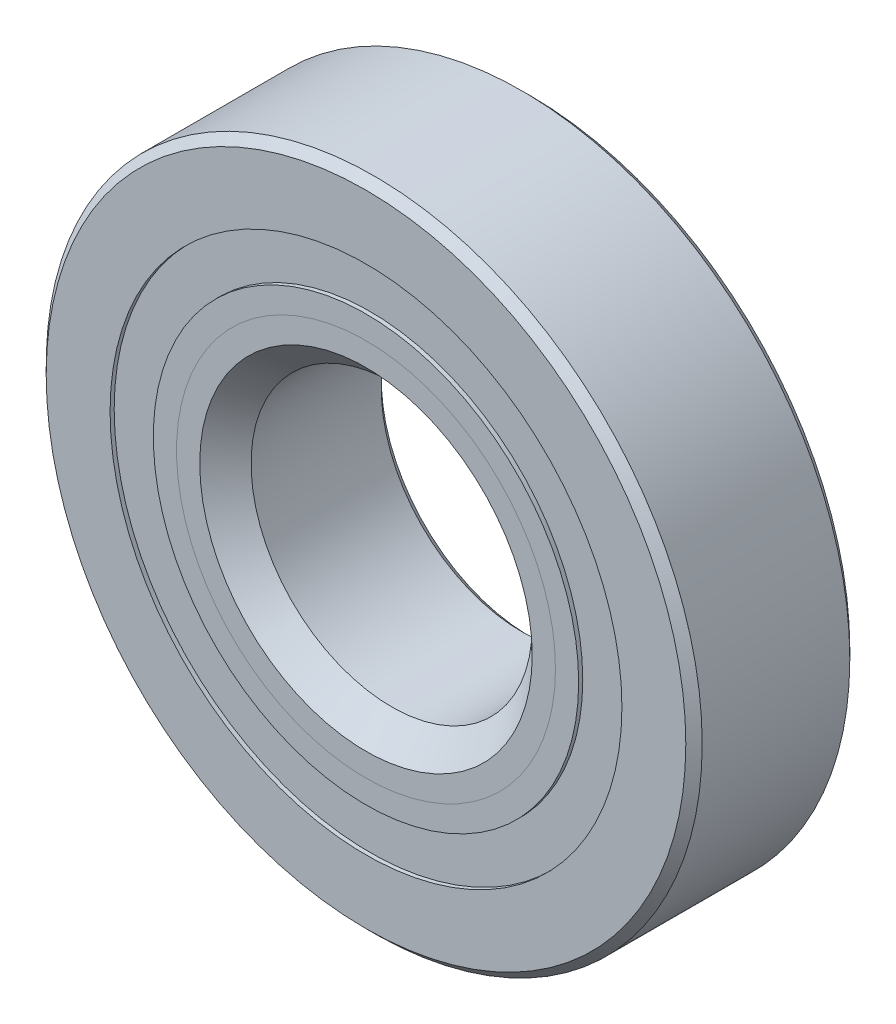
from build123d import *

# Parameters (mm, degrees)
CIRPATTERN1_COUNT = 12
SKETCH5_W         = 1.203469126
SKETCH5_H         = 1.465384616


with BuildPart() as part:
    # Sketch1 → Revolve1 (revolve)
    with BuildSketch(Plane(origin=(0, 0, 0), x_dir=(0, 0, -1), z_dir=(1, 0, 0))):
        with BuildLine():
            Line((2.5003125, 11.1125), (-2.5003125, 11.1125))
            Line((-2.5003125, 11.1125), (-2.778125, 10.8346875))
            Line((-2.778125, 10.8346875), (-2.778125, 8.670192308))
            Line((-2.778125, 8.670192308), (-1.234722222, 8.670192308))
            ThreePointArc((-1.234722222, 8.670192308), (0, 9.373249624), (1.234722222, 8.670192308))
            Line((1.234722222, 8.670192308), (2.778125, 8.670192308))
            Line((2.778125, 8.670192308), (2.778125, 10.8346875))
            Line((2.778125, 10.8346875), (2.5003125, 11.1125))
        make_face()
    revolve(axis=Axis((0, 0, 2.778125), (0, 0, -1)))


with BuildPart() as body_2:
    # Sketch2 → Revolve2 (revolve)
    with BuildSketch(Plane(origin=(0, 0, 0), x_dir=(0, 0, -1), z_dir=(1, 0, 0))):
        with BuildLine():
            Line((-2.778125, 7.204807692), (-1.234722222, 7.204807692))
            ThreePointArc((-1.234722222, 7.204807692), (-0.710427434, 6.689834242), (0, 6.501750376))
            Line((0, 6.501750376), (0, 5.632125188))
            Line((0, 5.632125188), (-1.991783748, 5.632125188))
            Line((-1.991783748, 5.632125188), (-2.778125, 6.41846644))
            Line((-2.778125, 6.41846644), (-2.778125, 7.204807692))
        make_face()
    revolve(axis=Axis((0, 0, 2.778125), (0, 0, -1)))


with BuildPart() as body_3:
    # Sketch3 → Revolve3 (revolve)
    with BuildSketch(Plane(origin=(0, 0, 0), x_dir=(0, 0, -1), z_dir=(1, 0, 0))):
        with BuildLine():
            Line((-2.778125, 6.41846644), (-1.991783748, 5.632125188))
            Line((-1.991783748, 5.632125188), (0, 5.632125188))
            Line((0, 5.632125188), (0, 6.501750376))
            ThreePointArc((0, 6.501750376), (0.710427434, 6.689834242), (1.234722222, 7.204807692))
            Line((1.234722222, 7.204807692), (2.778125, 7.204807692))
            Line((2.778125, 7.204807692), (2.778125, 5.0403125))
            Line((2.778125, 5.0403125), (2.5003125, 4.7625))
            Line((2.5003125, 4.7625), (-1.908499812, 4.7625))
            Line((-1.908499812, 4.7625), (-2.778125, 5.632125188))
            Line((-2.778125, 5.632125188), (-2.778125, 6.41846644))
        make_face()
    revolve(axis=Axis((0, 0, 2.778125), (0, 0, -1)))


with BuildPart() as body_4:
    # Sketch4 → Revolve4 (revolve)
    with BuildSketch(Plane(origin=(0, 0, 0), x_dir=(0, 0, -1), z_dir=(1, 0, 0))):
        with BuildLine():
            Line((-1.435749624, 7.9375), (1.435749624, 7.9375))
            ThreePointArc((1.435749624, 7.9375), (0, 9.373249624), (-1.435749624, 7.9375))
        make_face()
    revolve(axis=Axis((0, 7.9375, 1.435749624), (0, 0, -1)))


with BuildPart() as cirpattern1_1:
    # CirPattern1: pattern copy
    add(body_4.part.rotate(Axis((0, 0, -2.778125), (0, 0, 1)), 1 * 360 / CIRPATTERN1_COUNT))


with BuildPart() as cirpattern1_2:
    # CirPattern1: pattern copy
    add(body_4.part.rotate(Axis((0, 0, -2.778125), (0, 0, 1)), 2 * 360 / CIRPATTERN1_COUNT))


with BuildPart() as cirpattern1_3:
    # CirPattern1: pattern copy
    add(body_4.part.rotate(Axis((0, 0, -2.778125), (0, 0, 1)), 3 * 360 / CIRPATTERN1_COUNT))


with BuildPart() as cirpattern1_4:
    # CirPattern1: pattern copy
    add(body_4.part.rotate(Axis((0, 0, -2.778125), (0, 0, 1)), 4 * 360 / CIRPATTERN1_COUNT))


with BuildPart() as cirpattern1_5:
    # CirPattern1: pattern copy
    add(body_4.part.rotate(Axis((0, 0, -2.778125), (0, 0, 1)), 5 * 360 / CIRPATTERN1_COUNT))


with BuildPart() as cirpattern1_6:
    # CirPattern1: pattern copy
    add(body_4.part.rotate(Axis((0, 0, -2.778125), (0, 0, 1)), 6 * 360 / CIRPATTERN1_COUNT))


with BuildPart() as cirpattern1_7:
    # CirPattern1: pattern copy
    add(body_4.part.rotate(Axis((0, 0, -2.778125), (0, 0, 1)), 7 * 360 / CIRPATTERN1_COUNT))


with BuildPart() as cirpattern1_8:
    # CirPattern1: pattern copy
    add(body_4.part.rotate(Axis((0, 0, -2.778125), (0, 0, 1)), 8 * 360 / CIRPATTERN1_COUNT))


with BuildPart() as cirpattern1_9:
    # CirPattern1: pattern copy
    add(body_4.part.rotate(Axis((0, 0, -2.778125), (0, 0, 1)), 9 * 360 / CIRPATTERN1_COUNT))


with BuildPart() as cirpattern1_10:
    # CirPattern1: pattern copy
    add(body_4.part.rotate(Axis((0, 0, -2.778125), (0, 0, 1)), 10 * 360 / CIRPATTERN1_COUNT))


with BuildPart() as cirpattern1_11:
    # CirPattern1: pattern copy
    add(body_4.part.rotate(Axis((0, 0, -2.778125), (0, 0, 1)), 11 * 360 / CIRPATTERN1_COUNT))


with BuildPart() as body_16:
    # Sketch5 → Revolve5 (revolve)
    with BuildSketch(Plane(origin=(0, 0, 0), x_dir=(0, 0, -1), z_dir=(1, 0, 0))):
        with Locations((-2.037484187, 7.9375)):
            Rectangle(SKETCH5_W, SKETCH5_H)
        with Locations((2.037484187, 7.9375)):
            Rectangle(SKETCH5_W, SKETCH5_H)
    revolve(axis=Axis((0, 0, 2.778125), (0, 0, -1)))


solid = Compound([part.part, body_2.part, body_3.part, body_4.part, cirpattern1_1.part, cirpattern1_2.part, cirpattern1_3.part, cirpattern1_4.part, cirpattern1_5.part, cirpattern1_6.part, cirpattern1_7.part, cirpattern1_8.part, cirpattern1_9.part, cirpattern1_10.part, cirpattern1_11.part, body_16.part])
